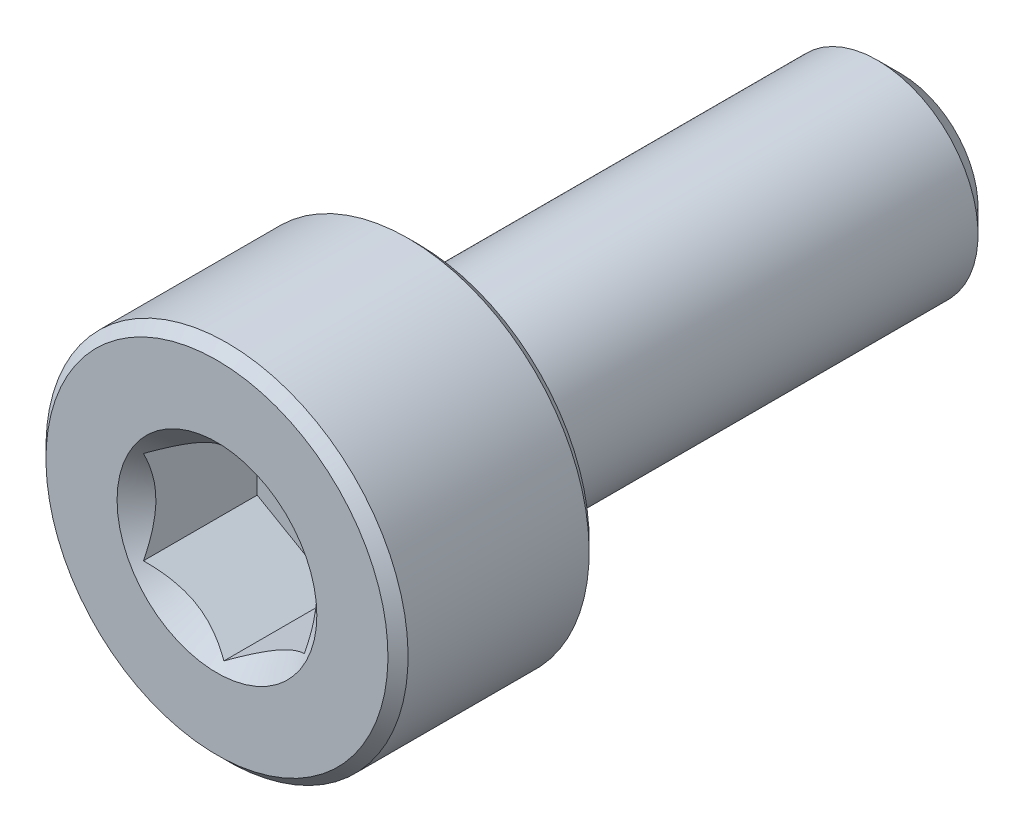
from build123d import *

# Parameters (mm, degrees)
CUT_EXTRUDE1_DEPTH     = 1.5
SPLIT1_SURFACE_1_BACK  = 11.618
SPLIT1_SURFACE_1_DEPTH = 23.236
SPLIT1_SURFACE_2_BACK  = 11.618
SPLIT1_SURFACE_2_DEPTH = 23.236


with BuildPart() as part:
    # Sketch2 → Revolve1 (revolve)
    with BuildSketch(Plane(origin=(0, 0, 0), x_dir=(0, 0, -1), z_dir=(1, 0, 0))):
        with BuildLine():
            Line((-4.25, 0), (-4.25, 2.125))
            Line((-4.25, 2.125), (-4.125, 2.25))
            Line((-4.125, 2.25), (-1.875, 2.25))
            Line((-1.875, 2.25), (-1.75, 2.125))
            Line((-1.75, 2.125), (-1.75, 1.375))
            ThreePointArc((-1.75, 1.375), (-1.713388348, 1.286611652), (-1.625, 1.25))
            Line((-1.625, 1.25), (3.957716426, 1.25))
            Line((3.957716426, 1.25), (4.25, 0.957716426))
            Line((4.25, 0.957716426), (4.25, 0))
            Line((4.25, 0), (-4.25, 0))
        make_face()
    revolve(axis=Axis((0, 0, -4.25), (0, 0, 1)))

    # Sketch3 → Cut-Extrude1 (cut)
    with BuildSketch(Plane.XY.offset(4.25)):
        Polygon((1, -0.577350269), (1, 0.577350269), (0, 1.154700538), (-1, 0.577350269), (-1, -0.577350269), (0, -1.154700538), align=None)
    extrude(amount=-CUT_EXTRUDE1_DEPTH, mode=Mode.SUBTRACT)

    # Cut-Extrude2 cone 1 section (through the dimple's axis) → Cut-Extrude2 (revolve, cut)
    with BuildSketch(Plane(origin=(0, 0, 4.25), x_dir=(0, -1, 0), z_dir=(1, 0, 0))):
        Polygon((0, 0), (1.241303079, 0), (0, 1.241303079), align=None)
    revolve(axis=Axis((0, 0, 4.25), (0, 0, -1)), mode=Mode.SUBTRACT)


with BuildPart() as body_2:
    # Split1: the piece behind the surface
    add(part.part)
    # Split1 surface: a surface, the sketch's curves swept straight by 23.236 mm
    with BuildLine(Plane(origin=(0, 0, 0), x_dir=(0, 0, -1), z_dir=(1, 0, 0)).offset(-SPLIT1_SURFACE_1_BACK), mode=Mode.PRIVATE) as split1_surface_1_path:
        Line((-1.625, -2.25), (-1.625, 2.25))
    split1_surface_1 = Shell.extrude(split1_surface_1_path.wire(), (1 * SPLIT1_SURFACE_1_DEPTH, 0 * SPLIT1_SURFACE_1_DEPTH, 0 * SPLIT1_SURFACE_1_DEPTH))
    split(bisect_by=split1_surface_1, keep=Keep.BOTTOM)


with BuildPart() as part_1:
    add(part.part)

    # Split1: split by a surface, the side it looks to stays
    # Split1 surface: a surface, the sketch's curves swept straight by 23.236 mm
    with BuildLine(Plane(origin=(0, 0, 0), x_dir=(0, 0, -1), z_dir=(1, 0, 0)).offset(-SPLIT1_SURFACE_2_BACK), mode=Mode.PRIVATE) as split1_surface_2_path:
        Line((-1.625, -2.25), (-1.625, 2.25))
    split1_surface_2 = Shell.extrude(split1_surface_2_path.wire(), (1 * SPLIT1_SURFACE_2_DEPTH, 0 * SPLIT1_SURFACE_2_DEPTH, 0 * SPLIT1_SURFACE_2_DEPTH))
    split(bisect_by=split1_surface_2, keep=Keep.TOP)

    # Sketch8 → Revolve2 (revolve)
    with BuildSketch(Plane(origin=(0, 0, 0), x_dir=(0, 0, -1), z_dir=(1, 0, 0)), mode=Mode.PRIVATE) as revolve2_sk:
        Polygon((-1.75, 0), (-1.75, 1.25), (-1.625, 1.25), (-0.903312164, 0), align=None)
    revolve(revolve2_sk.sketch.rotate(Axis((0, 0, 0.903312164), (0, 0, 1)), 270), axis=Axis((0, 0, 0.903312164), (0, 0, 1)))


solid = Compound([body_2.part, part_1.part])
